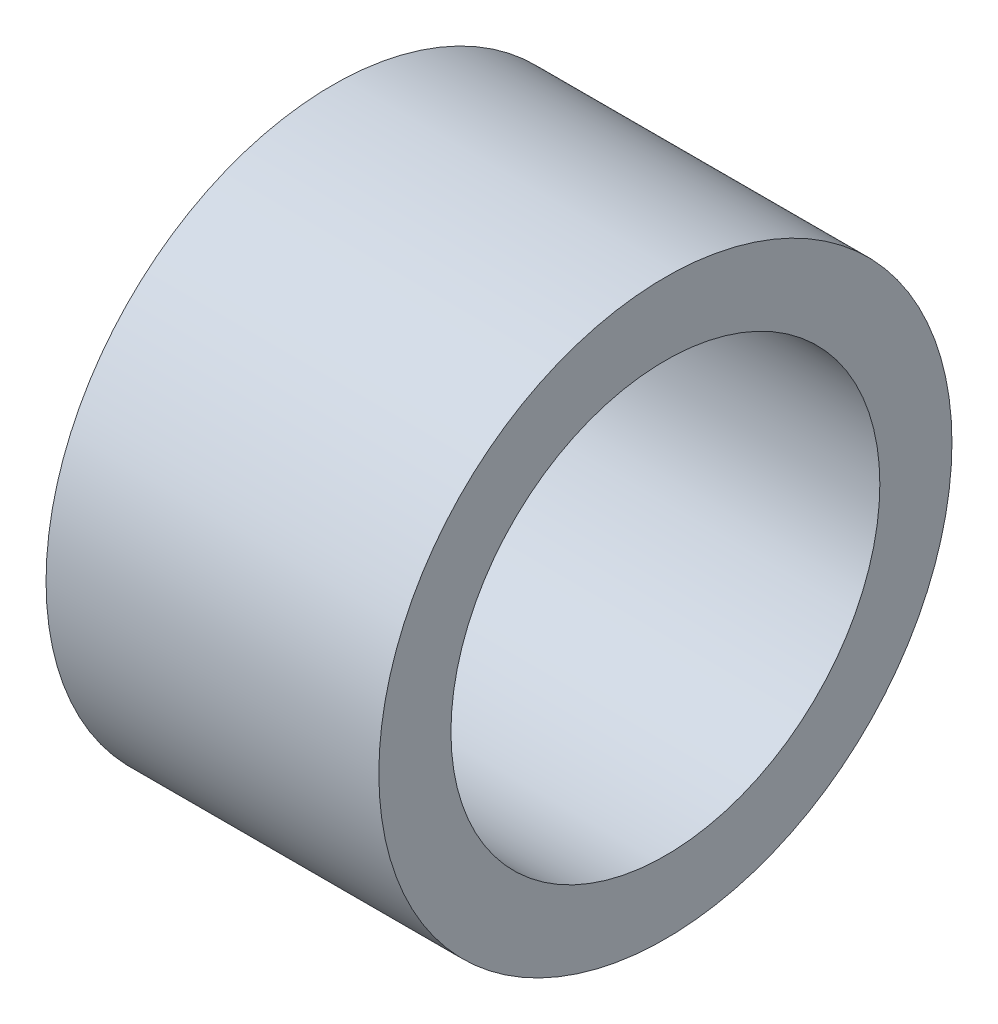
from build123d import *

# Parameters (mm, degrees)
SKETCH1_R           = 7.75
SKETCH1_R_2         = 5.8
BOSS_EXTRUDE1_DEPTH = 9


with BuildPart() as part:
    # Sketch1 → Boss-Extrude1 (new body)
    with BuildSketch(Plane(origin=(0, 0, 0), x_dir=(0, 0, -1), z_dir=(1, 0, 0))):
        Circle(SKETCH1_R)
        Circle(SKETCH1_R_2, mode=Mode.SUBTRACT)
    extrude(amount=BOSS_EXTRUDE1_DEPTH)


solid = part.part
